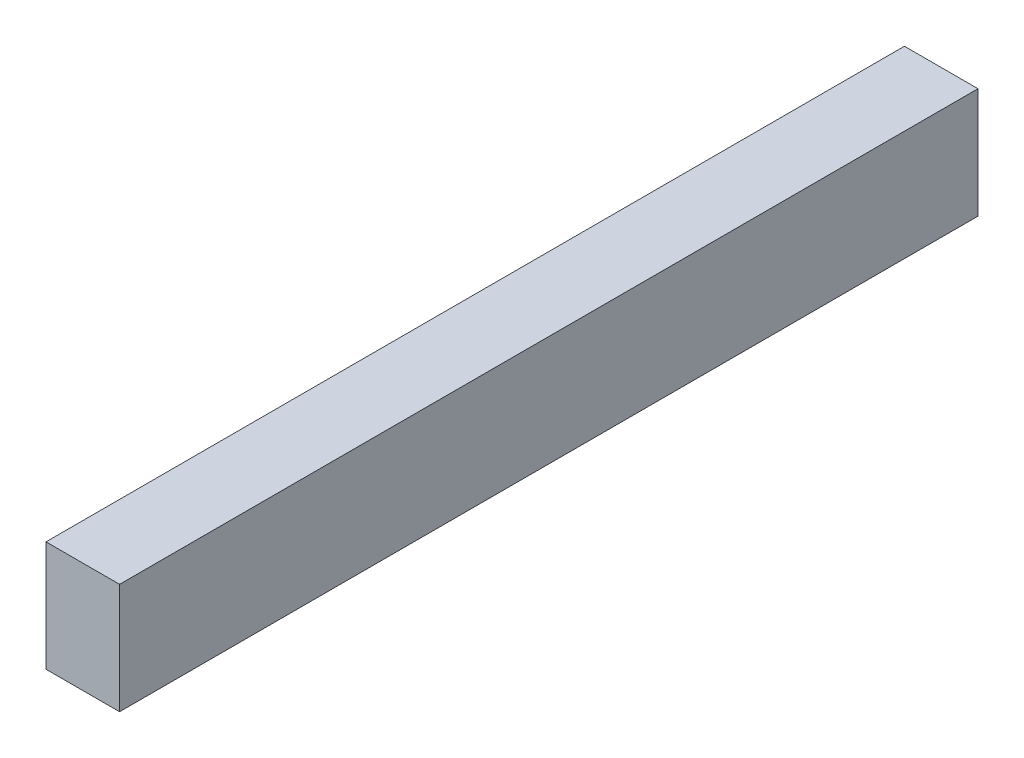
from build123d import *

# Parameters (mm, degrees)
SKETCH2_W           = 18
SKETCH2_H           = 210
BOSS_EXTRUDE1_DEPTH = 27


with BuildPart() as part:
    # Sketch2 → Boss-Extrude1 (new body)
    with BuildSketch(Plane(origin=(0, 0, 0), x_dir=(1, 0, 0), z_dir=(0, 1, 0))):
        with Locations((-13.344827586, -80.039408867)):
            Rectangle(SKETCH2_W, SKETCH2_H)
    extrude(amount=BOSS_EXTRUDE1_DEPTH)


solid = part.part
